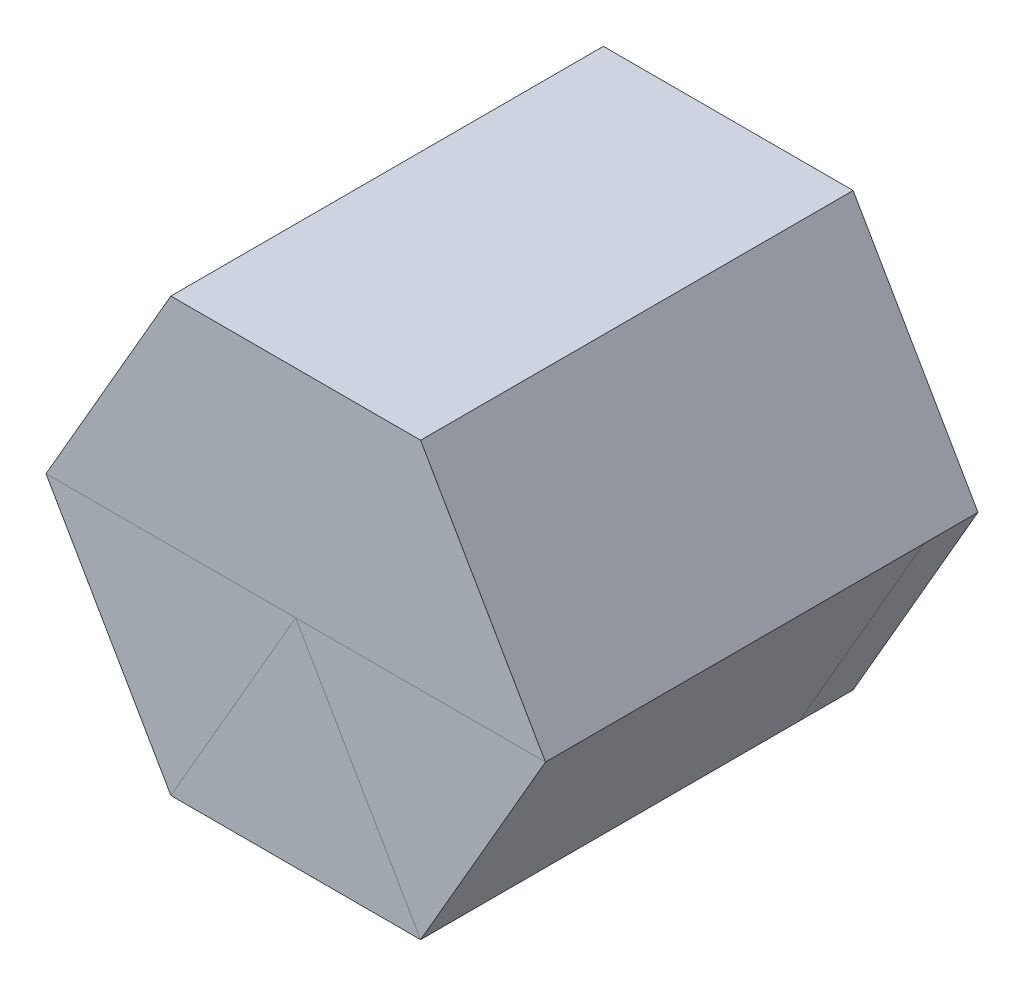
from build123d import *

# Parameters (mm, degrees)
BOSS_EXTRUDE5_DEPTH = 50.8
BOSS_EXTRUDE6_DEPTH = 6.35
BOSS_EXTRUDE7_START = 6.35
BOSS_EXTRUDE7_DEPTH = 44.45
BOSS_EXTRUDE8_START = 6.35
BOSS_EXTRUDE8_DEPTH = 44.45
BOSS_EXTRUDE9_START = 6.35
BOSS_EXTRUDE9_DEPTH = 44.45


with BuildPart() as part:
    # Sketch1 → Boss-Extrude5 (new body)
    with BuildSketch(Plane.XY):
        Polygon((0, 0), (-29.329393675, 0), (-14.664696837, 25.4), align=None)
        Polygon((-14.664696837, 25.4), (0, 0), (14.664696837, 25.4), align=None)
        Polygon((0, 0), (14.664696837, 25.4), (29.329393675, 0), align=None)
    extrude(amount=BOSS_EXTRUDE5_DEPTH)

    # Sketch1<8> → Boss-Extrude6 (add)
    with BuildSketch(Plane.XY):
        Polygon((-29.329393675, 0), (-14.664696837, -25.4), (0, 0), align=None)
        Polygon((-14.664696837, -25.4), (14.664696837, -25.4), (0, 0), align=None)
        Polygon((14.664696837, -25.4), (0, 0), (29.329393675, 0), align=None)
    extrude(amount=BOSS_EXTRUDE6_DEPTH)


with BuildPart() as body_2:
    # Sketch1<9> → Boss-Extrude7 (new body)
    with BuildSketch(Plane.XY.offset(BOSS_EXTRUDE7_START)):
        Polygon((-29.329393675, 0), (-14.664696837, -25.4), (0, 0), align=None)
    extrude(amount=BOSS_EXTRUDE7_DEPTH)


with BuildPart() as body_3:
    # Sketch1<10> → Boss-Extrude8 (new body)
    with BuildSketch(Plane.XY.offset(BOSS_EXTRUDE8_START)):
        Polygon((-14.664696837, -25.4), (14.664696837, -25.4), (0, 0), align=None)
    extrude(amount=BOSS_EXTRUDE8_DEPTH)


with BuildPart() as body_4:
    # Sketch1<11> → Boss-Extrude9 (new body)
    with BuildSketch(Plane.XY.offset(BOSS_EXTRUDE9_START)):
        Polygon((14.664696837, -25.4), (0, 0), (29.329393675, 0), align=None)
    extrude(amount=BOSS_EXTRUDE9_DEPTH)


solid = Compound([part.part, body_2.part, body_3.part, body_4.part])
